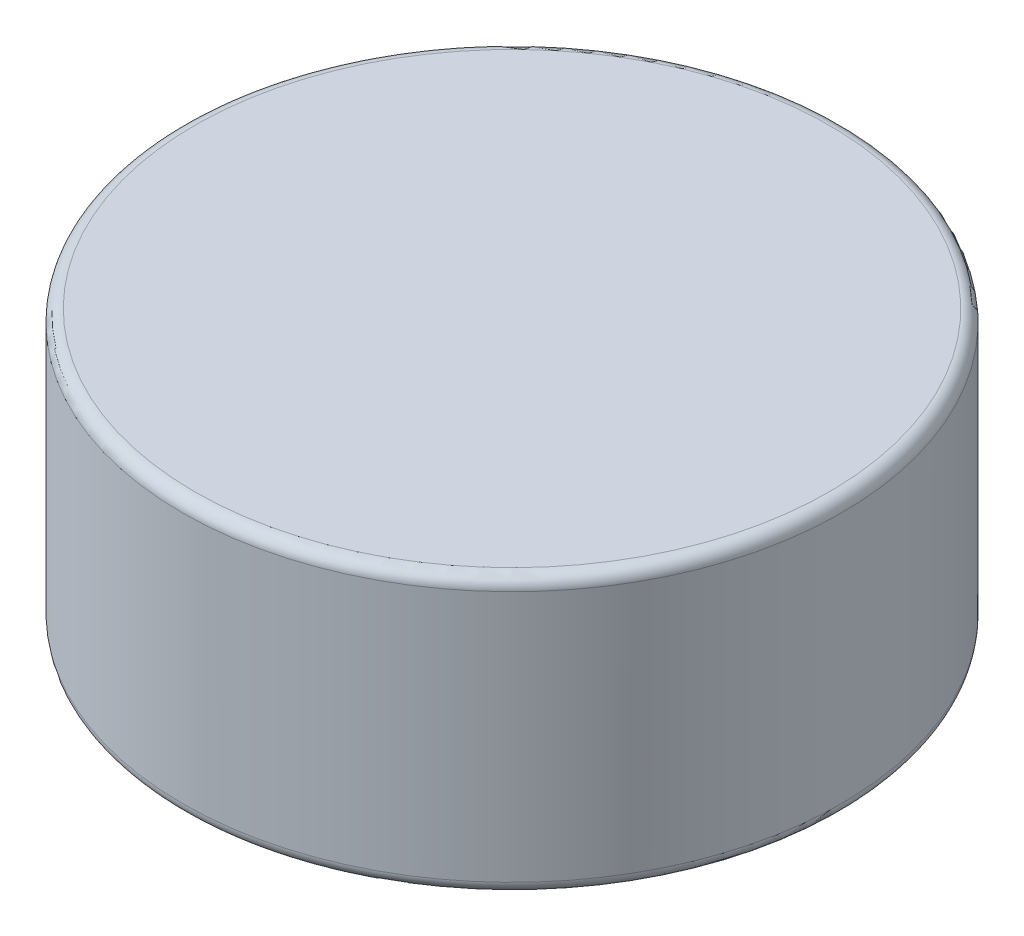
from build123d import *

# Parameters (mm, degrees)
FILLET1_R = 0.5


with BuildPart() as part:
    # Sketch1 → Revolve1 (revolve)
    with BuildSketch(Plane(origin=(0, 0, 0), x_dir=(0, 0, -1), z_dir=(1, 0, 0))):
        Polygon((-11.5, -4.319482084), (-11.5, 3.991295481), (0, 3.991295481), (0, 6.991295481), (-13.5, 6.991295481), (-13.5, -4.319482084), align=None)
    revolve(axis=Axis((0, 30.970585338, 0), (0, -1, 0)))

    # Fillet1
    fillet1_edges = [part.edges().sort_by_distance(p)[0] for p in [
        (0, -4.319482084, -13.5),
        (0, 6.991295481, -13.5),
    ]]
    fillet(fillet1_edges, radius=FILLET1_R)


solid = part.part
